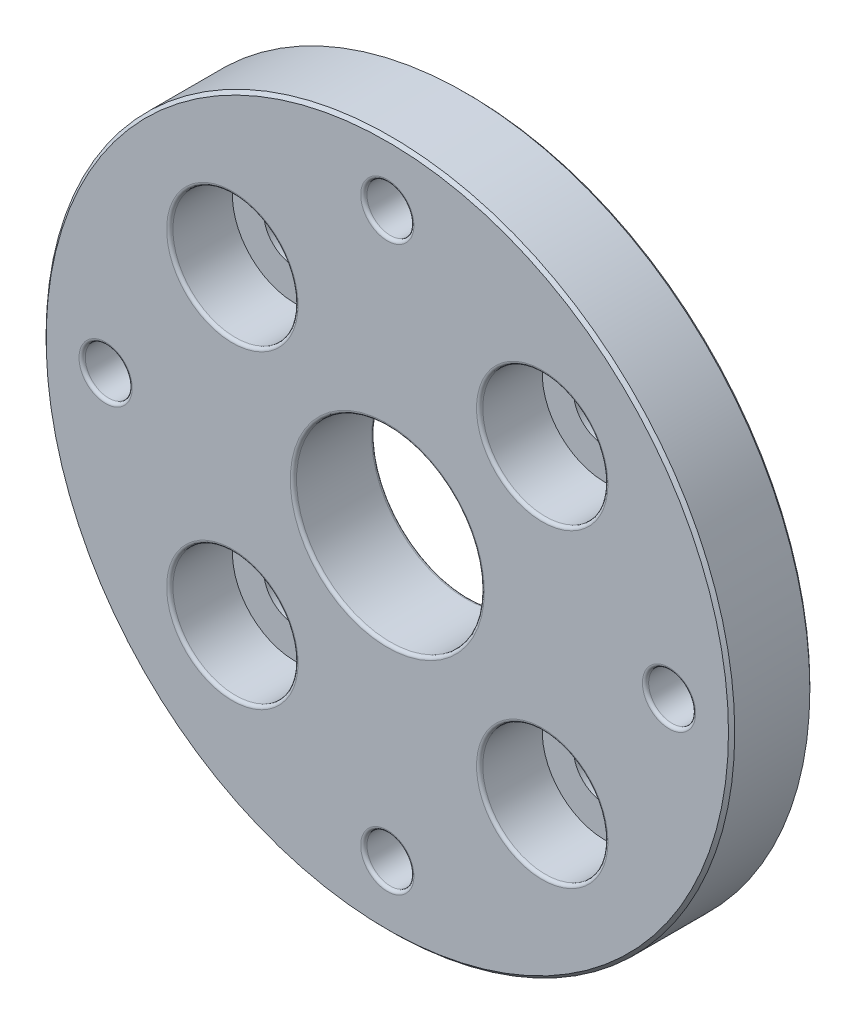
from build123d import *

# Parameters (mm, degrees)
SKETCH1_R           = 11
BOSS_EXTRUDE1_DEPTH = 2.6
SKETCH2_R           = 0.75
SKETCH2_R_2         = 1
CUT_EXTRUDE1_DEPTH  = 16.772127314
SKETCH3_R           = 2
CUT_EXTRUDE2_DEPTH  = 2
SKETCH4_R           = 3
CUT_EXTRUDE3_DEPTH  = 16.772127314
CHAMFER1_SIZE       = 0.1
FILLET1_R           = 0.1


with BuildPart() as part:
    # Sketch1 → Boss-Extrude1 (new body)
    with BuildSketch(Plane.XY):
        Circle(SKETCH1_R)
    extrude(amount=BOSS_EXTRUDE1_DEPTH)

    # Sketch2 → Cut-Extrude1 (cut, through all)
    with BuildSketch(Plane.XY.offset(2.6)):
        with Locations((0, 9)):
            Circle(SKETCH2_R)
        with Locations((9, 0)):
            Circle(SKETCH2_R)
        with Locations((0, -9)):
            Circle(SKETCH2_R)
        with Locations((-9, 0)):
            Circle(SKETCH2_R)
        with Locations((4.949747468, 4.949747468)):
            Circle(SKETCH2_R_2)
        with Locations((4.949747468, -4.949747468)):
            Circle(SKETCH2_R_2)
        with Locations((-4.949747468, -4.949747468)):
            Circle(SKETCH2_R_2)
        with Locations((-4.949747468, 4.949747468)):
            Circle(SKETCH2_R_2)
    extrude(amount=-CUT_EXTRUDE1_DEPTH, mode=Mode.SUBTRACT)

    # Sketch3 → Cut-Extrude2 (cut)
    with BuildSketch(Plane.XY.offset(2.6)):
        with Locations((4.949747468, 4.949747468)):
            Circle(SKETCH3_R)
        with Locations((4.949747468, -4.949747468)):
            Circle(SKETCH3_R)
        with Locations((-4.949747468, -4.949747468)):
            Circle(SKETCH3_R)
        with Locations((-4.949747468, 4.949747468)):
            Circle(SKETCH3_R)
    extrude(amount=-CUT_EXTRUDE2_DEPTH, mode=Mode.SUBTRACT)

    # Sketch4 → Cut-Extrude3 (cut, through all)
    with BuildSketch(Plane.XY.offset(2.6)):
        Circle(SKETCH4_R)
    extrude(amount=-CUT_EXTRUDE3_DEPTH, mode=Mode.SUBTRACT)

    # Chamfer1
    chamfer1_edges = [part.edges().sort_by_distance(p)[0] for p in [
        (-11, 0, 0),
        (-11, 0, 2.6),
    ]]
    chamfer(chamfer1_edges, length=CHAMFER1_SIZE)

    # Fillet1
    fillet1_edges = [part.edges().sort_by_distance(p)[0] for p in [
        (-0.75, 9, 0),
        (-0.75, 9, 2.6),
        (-5.949747468, 4.949747468, 0),
        (-5.949747468, -4.949747468, 0),
        (3.949747468, -4.949747468, 0),
        (-9.75, 0, 0),
        (-9.75, 0, 2.6),
        (-0.75, -9, 0),
        (-0.75, -9, 2.6),
        (8.25, 0, 0),
        (8.25, 0, 2.6),
        (3.949747468, 4.949747468, 0),
        (-6.949747468, 4.949747468, 2.6),
        (-6.949747468, -4.949747468, 2.6),
        (2.949747468, -4.949747468, 2.6),
        (2.949747468, 4.949747468, 2.6),
        (-3, 0, 0),
        (-3, 0, 2.6),
    ]]
    fillet(fillet1_edges, radius=FILLET1_R)


solid = part.part
